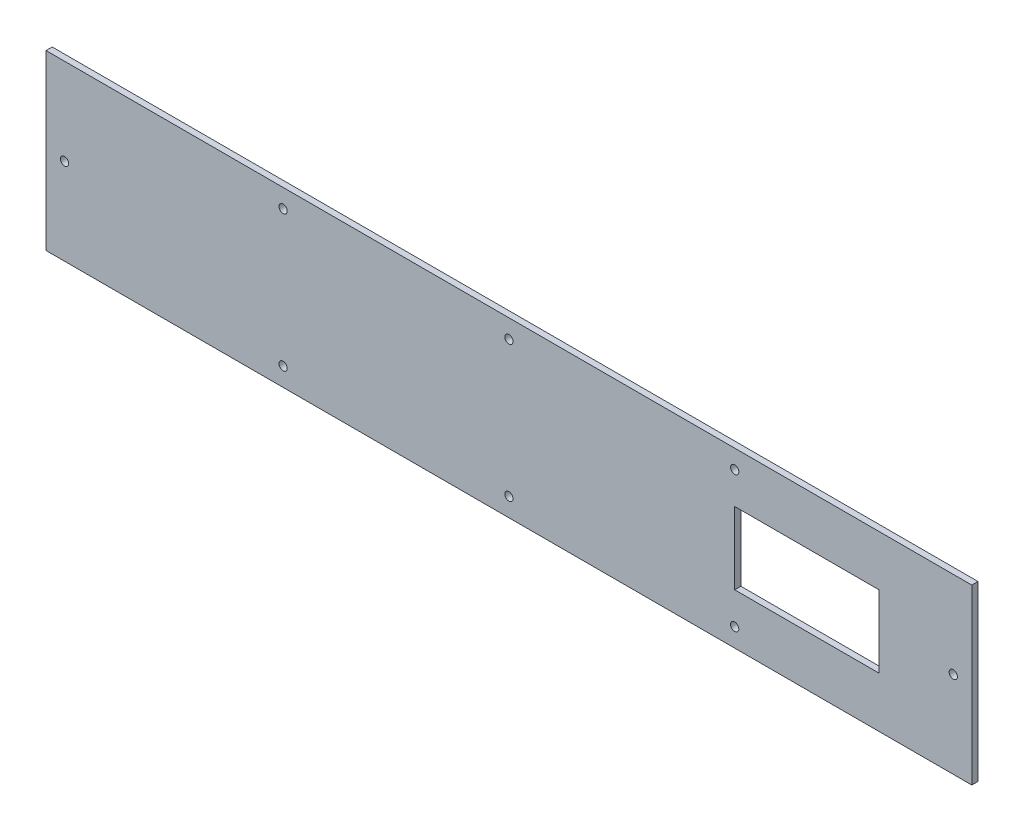
from build123d import *

# Parameters (mm, degrees)
SKETCH_F_W                   = 449
SKETCH_F_H                   = 84
SKETCH_F_R                   = 2
SKETCH_F_W_2                 = 70
SKETCH_F_H_2                 = 35
ESTRUSIONE_ESTRUSIONE1_DEPTH = 3


with BuildPart() as part:
    # Sketch f → Estrusione-Estrusione1 (new body)
    with BuildSketch(Plane.XY):
        with Locations((224.5, 42)):
            Rectangle(SKETCH_F_W, SKETCH_F_H)
        with Locations((9, 42)):
            Circle(SKETCH_F_R, mode=Mode.SUBTRACT)
        with Locations((224.5, 75)):
            Circle(SKETCH_F_R, mode=Mode.SUBTRACT)
        with Locations((224.5, 9)):
            Circle(SKETCH_F_R, mode=Mode.SUBTRACT)
        with Locations((440, 42)):
            Circle(SKETCH_F_R, mode=Mode.SUBTRACT)
        with Locations((334, 75)):
            Circle(SKETCH_F_R, mode=Mode.SUBTRACT)
        with Locations((334, 9)):
            Circle(SKETCH_F_R, mode=Mode.SUBTRACT)
        with Locations(Location((115, 9, 0), (0, 0, 180))):
            Circle(SKETCH_F_R, mode=Mode.SUBTRACT)
        with Locations(Location((115, 75, 0), (0, 0, 180))):
            Circle(SKETCH_F_R, mode=Mode.SUBTRACT)
        with Locations((369, 42)):
            Rectangle(SKETCH_F_W_2, SKETCH_F_H_2, mode=Mode.SUBTRACT)
    extrude(amount=ESTRUSIONE_ESTRUSIONE1_DEPTH)


solid = part.part
